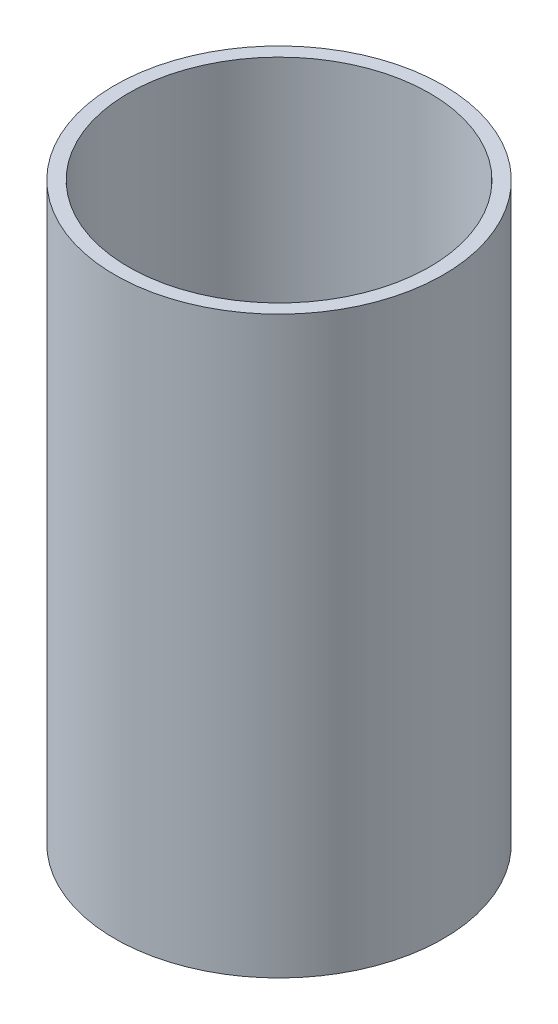
from build123d import *

# Parameters (mm, degrees)
SKETCH2_R           = 12
SKETCH2_R_2         = 11
BOSS_EXTRUDE1_DEPTH = 21


with BuildPart() as part:
    # Sketch2 → Boss-Extrude1 (new, symmetric)
    with BuildSketch(Plane(origin=(0, 0, 0), x_dir=(1, 0, 0), z_dir=(0, 1, 0))):
        with Locations(Location((0, 0, 0), (0, 0, 90))):
            Circle(SKETCH2_R)
        with Locations(Location((0, 0, 0), (0, 0, 90))):
            Circle(SKETCH2_R_2, mode=Mode.SUBTRACT)
    extrude(amount=BOSS_EXTRUDE1_DEPTH, both=True)


solid = part.part
